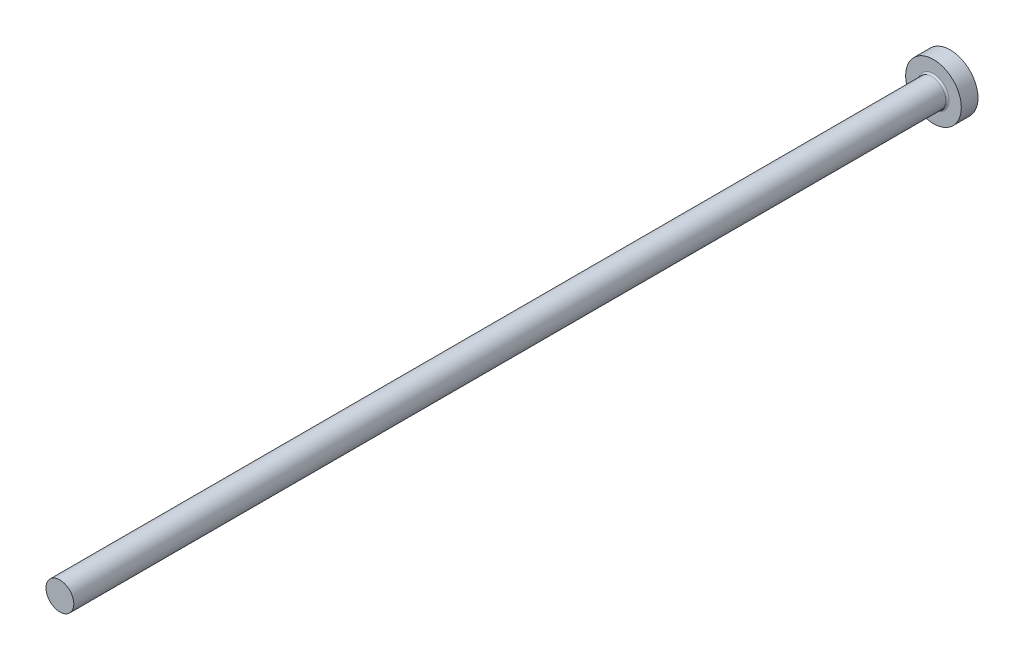
from build123d import *

# Parameters (mm, degrees)
SZKIC1_W = 3
SZKIC1_H = 5
SZKIC2_W = 157
SZKIC2_H = 2.5


with BuildPart() as part:
    # Szkic1 → Obrót1 (revolve)
    with BuildSketch(Plane(origin=(0, 0, 0), x_dir=(0, 0, -1), z_dir=(1, 0, 0))):
        with Locations((-1.5, 2.5)):
            Rectangle(SZKIC1_W, SZKIC1_H)
    revolve(axis=Axis((0, 0, 0), (0, 0, 1)))

    # Szkic2 → Obrót2 (revolve)
    with BuildSketch(Plane(origin=(0, 0, 0), x_dir=(0, 0, -1), z_dir=(1, 0, 0))):
        with Locations((-81.5, 1.25)):
            Rectangle(SZKIC2_W, SZKIC2_H)
    revolve(axis=Axis((0, 0, 3), (0, 0, 1)))

    # Szkic3 → Obrót3 (revolve)
    with BuildSketch(Plane(origin=(0, 0, 0), x_dir=(0, 0, -1), z_dir=(1, 0, 0))):
        with BuildLine():
            Line((-3.3, 2.5), (-3, 2.5))
            Line((-3, 2.5), (-3, 2.8))
            ThreePointArc((-3, 2.8), (-3.087867966, 2.587867966), (-3.3, 2.5))
        make_face()
    revolve(axis=Axis((0, 0, 0), (0, 0, 1)))


solid = part.part
